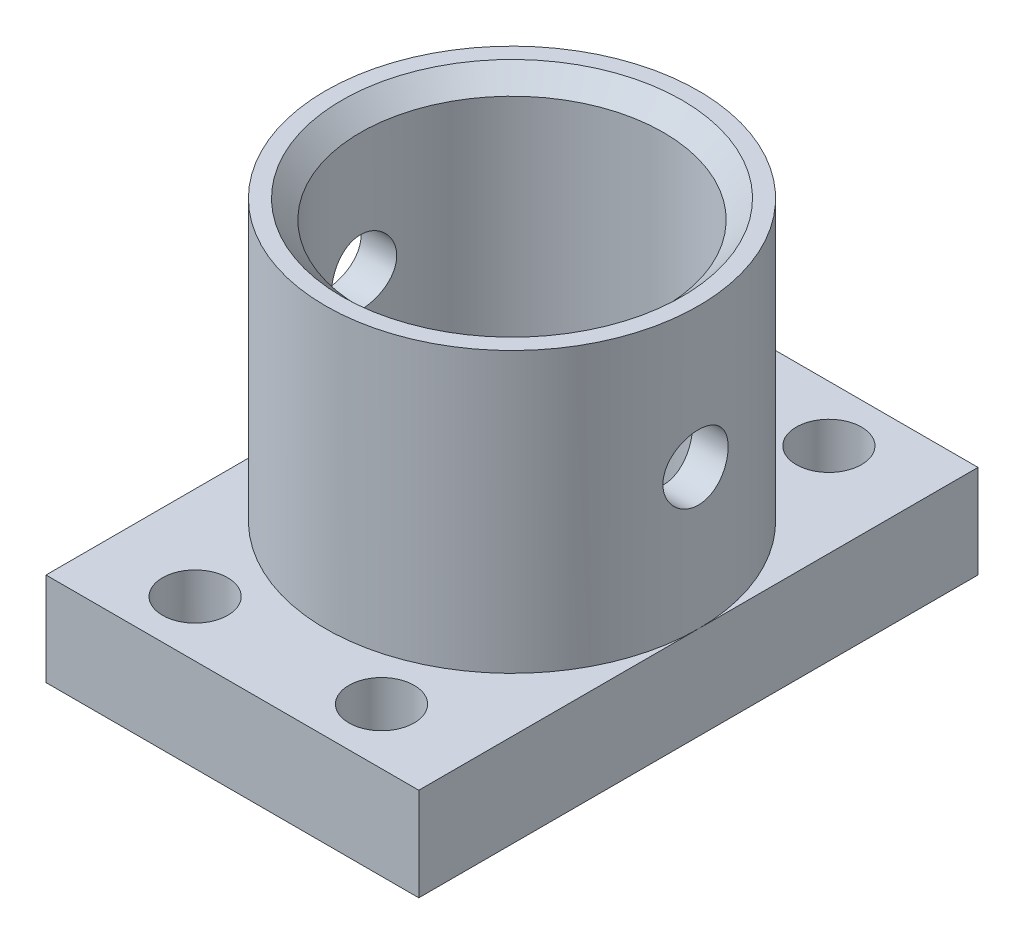
from build123d import *

# Parameters (mm, degrees)
SKETCH1_W               = 20
SKETCH1_H               = 30
BOSS_EXTRUDE1_DEPTH     = 5
SKETCH2_R               = 10
SKETCH2_R_2             = 8.125
BOSS_EXTRUDE2_DEPTH     = 15
CUT_EXTRUDE3_DEPTH      = 24.452078799
CUT_EXTRUDE3_DEPTH_BACK = 24.452078799
SKETCH5_R               = 8.125
SKETCH3_R               = 1.75
CUT_EXTRUDE1_DEPTH      = 5
CHAMFER1_SIZE           = 1
CUT_EXTRUDE2_DEPTH      = 27.925824036
CUT_EXTRUDE2_DEPTH_BACK = 27.925824036
SKETCH4_R               = 1.75


with BuildPart() as part:
    # Sketch1 → Boss-Extrude1 (new body)
    with BuildSketch(Plane(origin=(0, 0, 0), x_dir=(1, 0, 0), z_dir=(0, 1, 0))):
        Rectangle(SKETCH1_W, SKETCH1_H)
    extrude(amount=BOSS_EXTRUDE1_DEPTH)

    # Sketch2 → Boss-Extrude2 (add)
    with BuildSketch(Plane(origin=(0, 5, 0), x_dir=(1, 0, 0), z_dir=(0, 1, 0))):
        with Locations(Location((0, 0, 0), (0, 0, 180))):
            Circle(SKETCH2_R)
        with Locations(Location((0, 0, 0), (0, 0, 270))):
            Circle(SKETCH2_R_2, mode=Mode.SUBTRACT)
    extrude(amount=BOSS_EXTRUDE2_DEPTH)

    # Sketch5 → Cut-Extrude3 (cut, two sides: drawn at the far end of the back side and taken through both)
    with BuildSketch(Plane(origin=(0, 5, 0), x_dir=(1, 0, 0), z_dir=(0, 1, 0)).offset(-CUT_EXTRUDE3_DEPTH_BACK)):
        with Locations(Location((0, 0, 0), (0, 0, 270))):
            Circle(SKETCH5_R)
    extrude(amount=CUT_EXTRUDE3_DEPTH + CUT_EXTRUDE3_DEPTH_BACK, mode=Mode.SUBTRACT)

    # Sketch3 → Cut-Extrude1 (cut)
    with BuildSketch(Plane(origin=(0, 5, 0), x_dir=(1, 0, 0), z_dir=(0, 1, 0))):
        with Locations(Location((-5, 12, 0), (0, 0, 270))):
            Circle(SKETCH3_R)
        with Locations(Location((5, 12, 0), (0, 0, 270))):
            Circle(SKETCH3_R)
        with Locations(Location((5, -12, 0), (0, 0, 270))):
            Circle(SKETCH3_R)
        with Locations(Location((-5, -12, 0), (0, 0, 270))):
            Circle(SKETCH3_R)
    extrude(amount=-CUT_EXTRUDE1_DEPTH, mode=Mode.SUBTRACT)

    # Chamfer1
    chamfer1_edges = [part.edges().sort_by_distance(p)[0] for p in [
        (0, 20, -8.125),
    ]]
    chamfer(chamfer1_edges, length=CHAMFER1_SIZE)

    # Sketch4 → Cut-Extrude2 (cut, two sides: drawn at the far end of the back side and taken through both)
    with BuildSketch(Plane(origin=(0, 0, 0), x_dir=(0, 0, -1), z_dir=(1, 0, 0)).offset(-CUT_EXTRUDE2_DEPTH_BACK)):
        with Locations((0, 12.5)):
            Circle(SKETCH4_R)
    extrude(amount=CUT_EXTRUDE2_DEPTH + CUT_EXTRUDE2_DEPTH_BACK, mode=Mode.SUBTRACT)


solid = part.part
